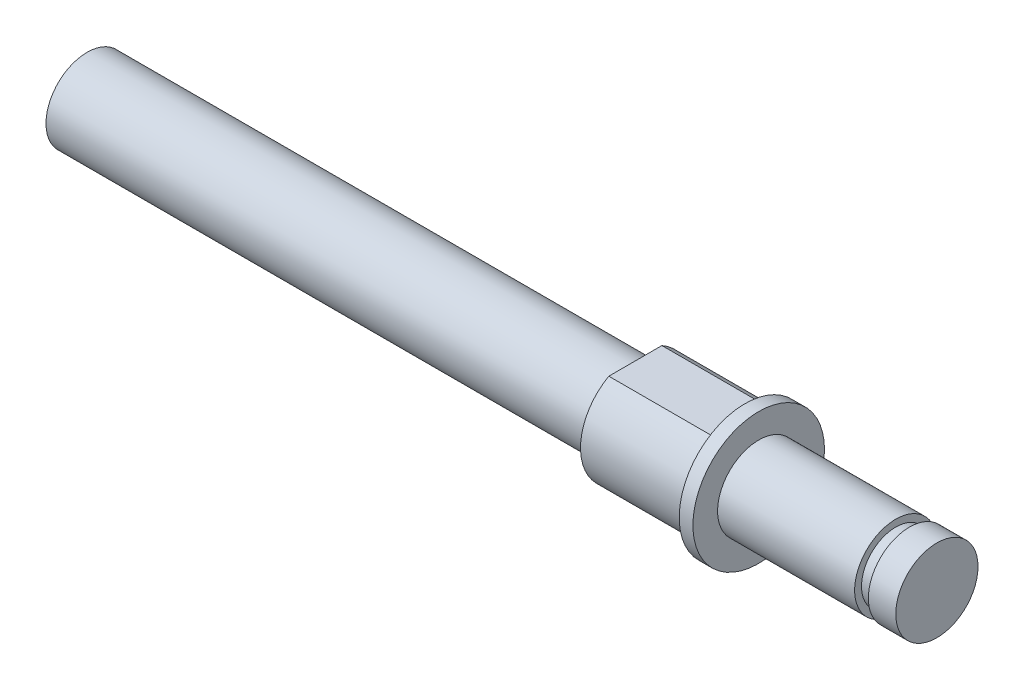
from build123d import *

# Parameters (mm, degrees)
SKETCH_1_R          = 1.5
EXTRUDE_1_DEPTH     = 31
SKETCH_2_R          = 1.5
EXTRUDE_2_DEPTH     = 4
SKETCH_3_R          = 2.4
SKETCH_3_R_2        = 1.5
EXTRUDE_3_DEPTH     = 0.5
CUT_EXTRUDE_START   = -1.5
SKETCH_4_R          = 1.5
SKETCH_4_R_2        = 1.25
CUT_EXTRUDE_1_DEPTH = 0.5


with BuildPart() as part:
    # 草图1 → 凸台-拉伸1 (new body)
    with BuildSketch(Plane(origin=(0, 0, 0), x_dir=(0, 0, -1), z_dir=(1, 0, 0))):
        Circle(SKETCH_1_R)
    extrude(amount=EXTRUDE_1_DEPTH)

    # 草图2 → 凸台-拉伸2 (add)
    with BuildSketch(Plane.ZY.offset(-20)):
        with BuildLine():
            Line((0.968245837, 1.75), (-0.968245837, 1.75))
            ThreePointArc((-0.968245837, 1.75), (0, -2), (0.968245837, 1.75))
        make_face()
        Circle(SKETCH_2_R, mode=Mode.SUBTRACT)
    extrude(amount=-EXTRUDE_2_DEPTH)

    # 草图3 → 凸台-拉伸3 (add)
    with BuildSketch(Plane(origin=(24, 0, 0), x_dir=(0, 0, -1), z_dir=(1, 0, 0))):
        Circle(SKETCH_3_R)
        with Locations(Location((0, 0, 0), (0, 0, 180))):
            Circle(SKETCH_3_R_2, mode=Mode.SUBTRACT)
    extrude(amount=EXTRUDE_3_DEPTH)

    # 草图4 → 切除-拉伸1 (cut)
    with BuildSketch(Plane(origin=(31, 0, 0), x_dir=(0, 0, -1), z_dir=(1, 0, 0)).offset(CUT_EXTRUDE_START)):
        Circle(SKETCH_4_R)
        Circle(SKETCH_4_R_2, mode=Mode.SUBTRACT)
    extrude(amount=CUT_EXTRUDE_1_DEPTH, mode=Mode.SUBTRACT)


solid = part.part
